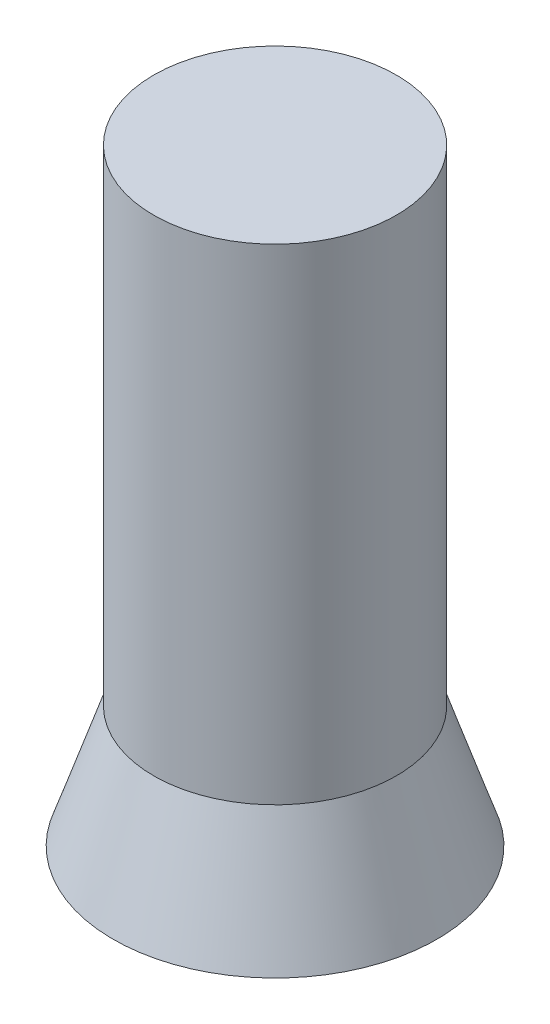
from build123d import *


with BuildPart() as part:
    # Sketch1 → Revolve3 (revolve)
    with BuildSketch(Plane.XY, mode=Mode.PRIVATE) as revolve3_sk:
        Polygon((0, 11.90625), (0, 0), (3.175, 0), (2.38125, 2.38125), (2.38125, 11.90625), align=None)
    revolve(revolve3_sk.sketch.rotate(Axis((0, 0, 0), (0, -1, 0)), 180), axis=Axis((0, 0, 0), (0, -1, 0)))


solid = part.part
